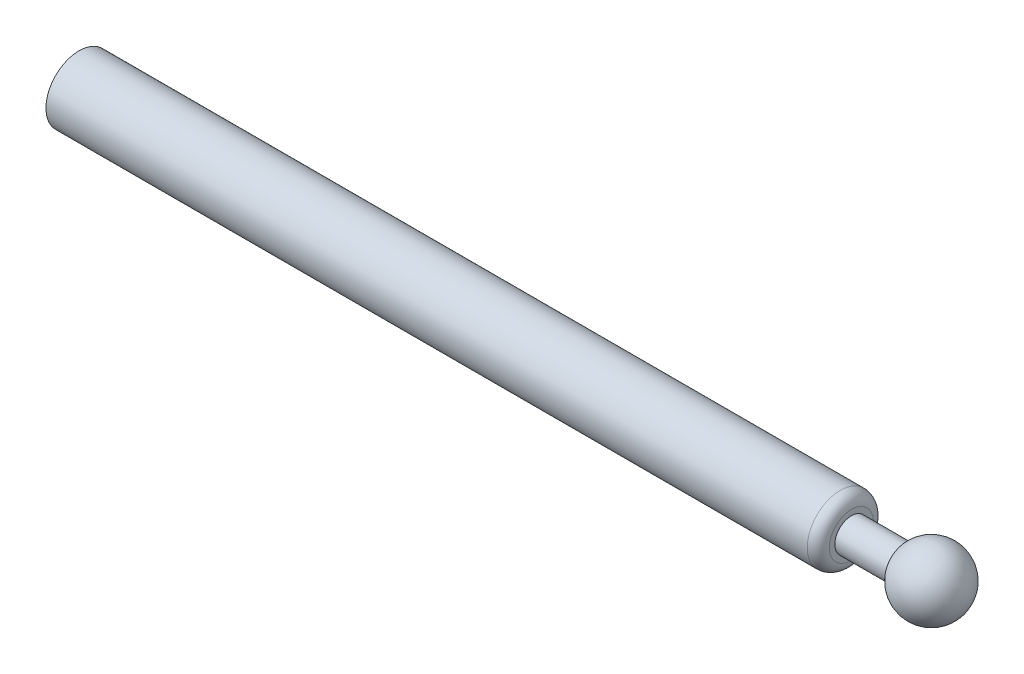
from build123d import *

# Parameters (mm, degrees)
SKETCH2_R           = 3
BOSS_EXTRUDE1_DEPTH = 70
SKETCH3_R           = 1.5
BOSS_EXTRUDE2_DEPTH = 5
FILLET1_R           = 1


with BuildPart() as part:
    # Sketch2 → Boss-Extrude1 (new body)
    with BuildSketch(Plane(origin=(0, 0, 0), x_dir=(0, 0, -1), z_dir=(1, 0, 0))):
        Circle(SKETCH2_R)
    extrude(amount=BOSS_EXTRUDE1_DEPTH)

    # Sketch3 → Boss-Extrude2 (add)
    with BuildSketch(Plane(origin=(70, 0, 0), x_dir=(0, 0, -1), z_dir=(1, 0, 0))):
        Circle(SKETCH3_R)
    extrude(amount=BOSS_EXTRUDE2_DEPTH)

    # Fillet1
    fillet1_edges = [part.edges().sort_by_distance(p)[0] for p in [
        (70, 0, 3),
    ]]
    fillet(fillet1_edges, radius=FILLET1_R)

    # Sketch4 → Revolve1 (revolve)
    with BuildSketch(Plane.XY):
        with BuildLine():
            Line((75, 0), (77.25, 0))
            Line((77.25, 0), (80.25, 0))
            ThreePointArc((80.25, 0), (77.25, -3), (74.25, 0))
            Line((74.25, 0), (75, 0))
        make_face()
    revolve(axis=Axis((75, 0, 0), (1, 0, 0)))


solid = part.part
